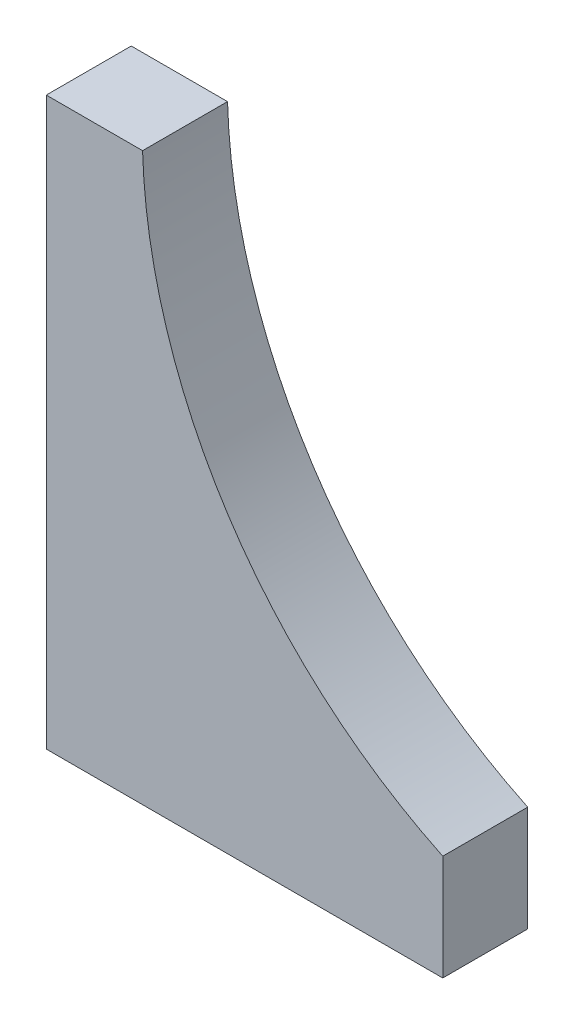
from build123d import *

# Parameters (mm, degrees)
BOSS_EXTRU_1_DEPTH      = 15
ESQUISSE7_R             = 2.5
ENL_V_MAT_EXTRU_4_DEPTH = 16
ESQUISSE5_R             = 2.5
ENL_V_MAT_EXTRU_5_DEPTH = 16
ESQUISSE8_R             = 2.5
ENL_V_MAT_EXTRU_6_DEPTH = 16
ESQUISSE9_R             = 2.5
ENL_V_MAT_EXTRU_7_DEPTH = 16
ENL_V_START             = -3
ESQUISSE10_W            = 11
ESQUISSE10_H            = 6.5
ESQUISSE10_W_2          = 9.5
ESQUISSE10_H_2          = 14.5
ENL_V_MAT_EXTRU_8_DEPTH = 9


with BuildPart() as part:
    # Esquisse1 → Boss.-Extru.1 (new body)
    with BuildSketch(Plane.XY):
        with BuildLine():
            Line((0, 100), (17, 100))
            ThreePointArc((17, 100), (32.078733461, 51.873825012), (70, 18.625148861))
            Line((70, 18.625148861), (70, 0))
            Line((70, 0), (0, 0))
            Line((0, 0), (0, 100))
        make_face()
    extrude(amount=BOSS_EXTRU_1_DEPTH)

    # Esquisse7 → Enlèv. mat.-Extru.4 (cut)
    with BuildSketch(Plane.ZY):
        with Locations((7.5, 25)):
            Circle(ESQUISSE7_R)
    extrude(amount=-ENL_V_MAT_EXTRU_4_DEPTH, mode=Mode.SUBTRACT)

    # Esquisse5 → Enlèv. mat.-Extru.5 (cut)
    with BuildSketch(Plane.ZY):
        with Locations((7.5, 85)):
            Circle(ESQUISSE5_R)
    extrude(amount=-ENL_V_MAT_EXTRU_5_DEPTH, mode=Mode.SUBTRACT)

    # Esquisse8 → Enlèv. mat.-Extru.6 (cut)
    with BuildSketch(Plane.XZ):
        with Locations(Location((20, 7.5, 0), (0, 0, 270))):
            Circle(ESQUISSE8_R)
    extrude(amount=-ENL_V_MAT_EXTRU_6_DEPTH, mode=Mode.SUBTRACT)

    # Esquisse9 → Enlèv. mat.-Extru.7 (cut)
    with BuildSketch(Plane.XZ):
        with Locations(Location((55, 7.5, 0), (0, 0, 270))):
            Circle(ESQUISSE9_R)
    extrude(amount=-ENL_V_MAT_EXTRU_7_DEPTH, mode=Mode.SUBTRACT)

    # Esquisse10 → Enlèv. mat.-Extru.8 (cut)
    with BuildSketch(Plane.XY.offset(15).offset(ENL_V_START)):
        with BuildLine():
            Line((3, 79.5), (15.014172538, 79.5))
            ThreePointArc((15.014172538, 79.5), (26.862682219, 51.335667796), (47.020836751, 28.373403185))
            Line((47.020836751, 28.373403185), (47.020836751, 22.591228546))
            Line((47.020836751, 22.591228546), (47.020836751, 18.330678811))
            Line((47.020836751, 18.330678811), (47.020836751, 3))
            Line((47.020836751, 3), (25.5, 3))
            Line((25.5, 3), (25.5, 14.739450265))
            Line((25.5, 14.739450265), (25.5, 19))
            Line((25.5, 19), (19, 19))
            Line((19, 19), (19, 30.5))
            Line((19, 30.5), (3, 30.5))
            Line((3, 30.5), (3, 79.5))
        make_face()
        with Locations((8.5, 93.75)):
            Rectangle(ESQUISSE10_W, ESQUISSE10_H)
        with Locations((8.75, 11.25)):
            Rectangle(ESQUISSE10_W_2, ESQUISSE10_H_2)
    extrude(amount=-ENL_V_MAT_EXTRU_8_DEPTH, mode=Mode.SUBTRACT)


solid = part.part
